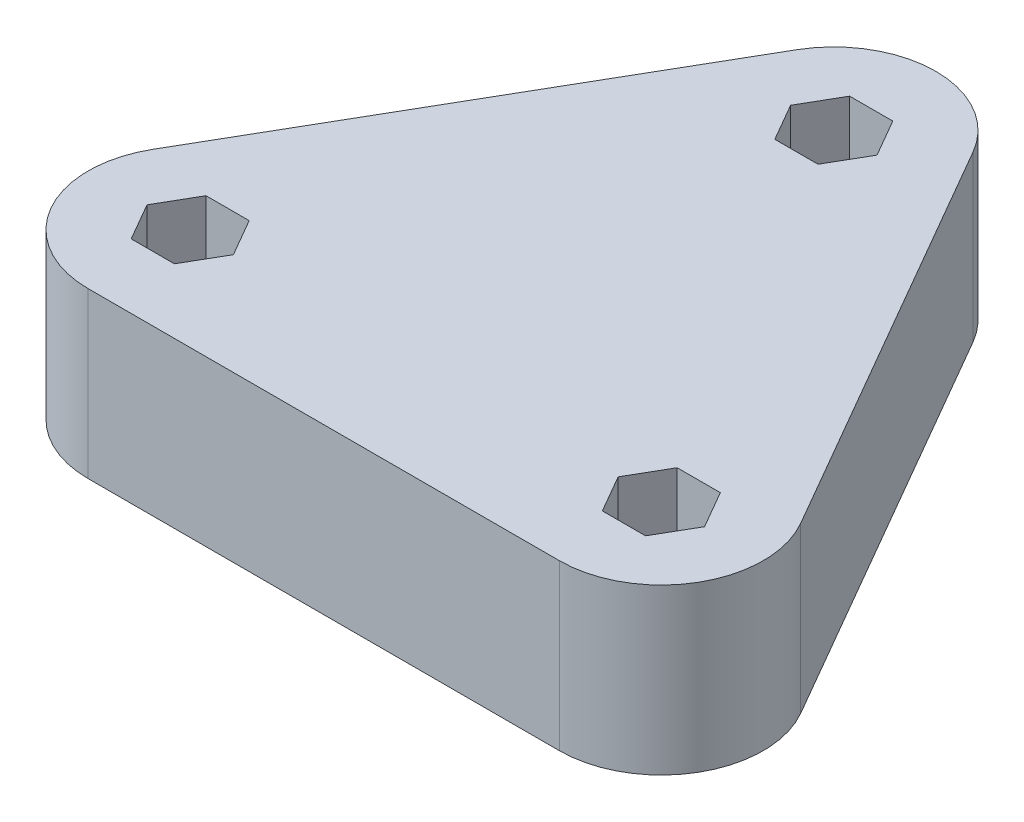
from build123d import *

# Parameters (mm, degrees)
ESQUISSE1_R             = 11.9
ESQUISSE1_R_2           = 2
BOSS_EXTRU_1_DEPTH      = 12
ENL_V_MAT_EXTRU_1_DEPTH = 5
SKETCH1_R               = 11.9
BOSS_EXTRUDE1_DEPTH     = 2
BOSS_EXTRUDE2_START     = 1.5
SKETCH2_R               = 15.5
SKETCH2_R_2             = 11.9
BOSS_EXTRUDE2_DEPTH     = 1.5
BOSS_EXTRUDE3_DEPTH     = 0.1


with BuildPart() as part:
    # Esquisse1 → Boss.-Extru.1 (new body)
    with BuildSketch(Plane(origin=(0, 0, 0), x_dir=(1, 0, 0), z_dir=(0, 1, 0))):
        with BuildLine():
            Line((-6.495190528, 23.75), (-23.815698604, -6.25))
            ThreePointArc((-23.815698604, -6.25), (-23.815698604, -13.75), (-17.320508076, -17.5))
            Line((-17.320508076, -17.5), (17.320508076, -17.5))
            ThreePointArc((17.320508076, -17.5), (23.815698604, -13.75), (23.815698604, -6.25))
            Line((23.815698604, -6.25), (6.495190528, 23.75))
            ThreePointArc((6.495190528, 23.75), (0, 27.5), (-6.495190528, 23.75))
        make_face()
        with Locations(Location((0, 0, 0), (0, 0, 270))):
            Circle(ESQUISSE1_R, mode=Mode.SUBTRACT)
        with Locations(Location((-17.320508076, -10, 0), (0, 0, 270))):
            Circle(ESQUISSE1_R_2, mode=Mode.SUBTRACT)
        with Locations(Location((0, 20, 0), (0, 0, 270))):
            Circle(ESQUISSE1_R_2, mode=Mode.SUBTRACT)
        with Locations(Location((17.320508076, -10, 0), (0, 0, 270))):
            Circle(ESQUISSE1_R_2, mode=Mode.SUBTRACT)
    extrude(amount=BOSS_EXTRU_1_DEPTH)

    # Esquisse2 → Enlèv. mat.-Extru.1 (cut)
    with BuildSketch(Plane(origin=(0, 12, 0), x_dir=(1, 0, 0), z_dir=(0, 1, 0))):
        Polygon((-18.908221316, -7.25), (-20.495934556, -10), (-18.908221316, -12.75), (-15.732794835, -12.75), (-14.145081595, -10), (-15.732794835, -7.25), align=None)
        Polygon((-1.58771324, 22.75), (-3.175426481, 20), (-1.58771324, 17.25), (1.58771324, 17.25), (3.175426481, 20), (1.58771324, 22.75), align=None)
        Polygon((18.908221316, -7.25), (15.732794835, -7.25), (14.145081595, -10), (15.732794835, -12.75), (18.908221316, -12.75), (20.495934556, -10), align=None)
    extrude(amount=-ENL_V_MAT_EXTRU_1_DEPTH, mode=Mode.SUBTRACT)

    # Sketch2 → Boss-Extrude2 (add)
    with BuildSketch(Plane.XZ.offset(BOSS_EXTRUDE2_START)):
        with Locations(Location((0, 0, 0), (0, 0, 90))):
            Circle(SKETCH2_R)
        with Locations(Location((0, 0, 0), (0, 0, 90))):
            Circle(SKETCH2_R_2, mode=Mode.SUBTRACT)
    extrude(amount=-BOSS_EXTRUDE2_DEPTH)



with BuildPart() as body_2:
    # Sketch1 → Boss-Extrude1 (new body)
    with BuildSketch(Plane(origin=(0, 12, 0), x_dir=(1, 0, 0), z_dir=(0, 1, 0))):
        with Locations(Location((0, 0, 0), (0, 0, 270))):
            Circle(SKETCH1_R)
    extrude(amount=-BOSS_EXTRUDE1_DEPTH)


with BuildPart() as part_1:
    add(part.part)

    add(body_2.part)  # Boss-Extrude3 merges body 2
    # Sketch3 → Boss-Extrude3 (add)
    with BuildSketch(Plane(origin=(0, 12, 0), x_dir=(1, 0, 0), z_dir=(0, 1, 0))):
        with BuildLine():
            Line((-6.495190528, 23.75), (-23.815698604, -6.25))
            ThreePointArc((-23.815698604, -6.25), (-23.815698604, -13.75), (-17.320508076, -17.5))
            Line((-17.320508076, -17.5), (17.320508076, -17.5))
            ThreePointArc((17.320508076, -17.5), (23.815698604, -13.75), (23.815698604, -6.25))
            Line((23.815698604, -6.25), (6.495190528, 23.75))
            ThreePointArc((6.495190528, 23.75), (0, 27.5), (-6.495190528, 23.75))
        make_face()
        Polygon((-1.58771324, 22.75), (-3.175426481, 20), (-1.58771324, 17.25), (1.58771324, 17.25), (3.175426481, 20), (1.58771324, 22.75), align=None, mode=Mode.SUBTRACT)
        Polygon((18.908221316, -12.75), (20.495934556, -10), (18.908221316, -7.25), (15.732794835, -7.25), (14.145081595, -10), (15.732794835, -12.75), align=None, mode=Mode.SUBTRACT)
        Polygon((-18.908221316, -7.25), (-20.495934556, -10), (-18.908221316, -12.75), (-15.732794835, -12.75), (-14.145081595, -10), (-15.732794835, -7.25), align=None, mode=Mode.SUBTRACT)
    extrude(amount=BOSS_EXTRUDE3_DEPTH)


solid = part_1.part
